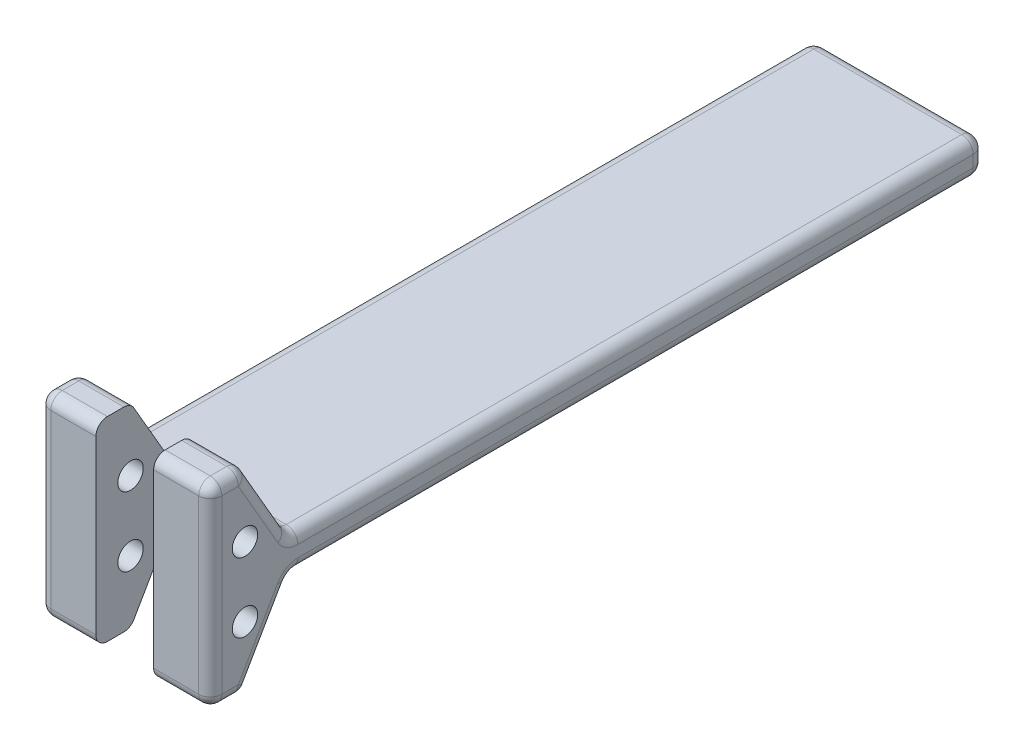
from build123d import *

# Parameters (mm, degrees)
SKETCH_1_W               = 14.8
SKETCH_1_H               = 3
EXTRUDE_1_DEPTH          = 30
EXTRUDE_START            = 2.5
EXTRUDE_2_DEPTH          = 4.9
EXTRUDE_START_2          = -2.5
EXTRUDE_3_DEPTH          = 4.9
FILLET_1_R               = 1
CUT_EXTRUDE_1_DEPTH      = 41.731739622
CUT_EXTRUDE_1_DEPTH_BACK = 41.731739622
SKETCH_4_R               = 1.1


with BuildPart() as part:
    # Эскиз1 → Бобышка-Вытянуть1 (new, symmetric)
    with BuildSketch(Plane.XY):
        Rectangle(SKETCH_1_W, SKETCH_1_H)
    extrude(amount=EXTRUDE_1_DEPTH, both=True)

    # Эскиз3 → Бобышка-Вытянуть2 (add)
    with BuildSketch(Plane(origin=(0, 0, 0), x_dir=(0, 0, -1), z_dir=(1, 0, 0)).offset(EXTRUDE_START)):
        Polygon((-30, 1.5), (-34, 8.42820323), (-37, 8.42820323), (-37, -8.42820323), (-34, -8.42820323), (-30, -1.5), align=None)
    extrude(amount=EXTRUDE_2_DEPTH)

    # Эскиз3<2> → Бобышка-Вытянуть3 (add)
    with BuildSketch(Plane(origin=(0, 0, 0), x_dir=(0, 0, -1), z_dir=(1, 0, 0)).offset(EXTRUDE_START_2)):
        Polygon((-30, 1.5), (-34, 8.42820323), (-37, 8.42820323), (-37, -8.42820323), (-34, -8.42820323), (-30, -1.5), align=None)
    extrude(amount=-EXTRUDE_3_DEPTH)

    # Скругление1
    fillet_1_edges = [part.edges().sort_by_distance(p)[0] for p in [
        (7.4, -4.964101615, 32),
        (4.95, -8.42820323, 34),
        (7.4, -8.42820323, 35.5),
        (4.95, -8.42820323, 37),
        (7.4, 0, 37),
        (4.95, 8.42820323, 37),
        (7.4, 8.42820323, 35.5),
        (4.95, 8.42820323, 34),
        (7.4, 4.964101615, 32),
        (-4.95, -1.5, 30),
        (4.95, -1.5, 30),
        (-4.95, 1.5, 30),
        (-4.95, -8.42820323, 34),
        (-4.95, -8.42820323, 37),
        (-4.95, 8.42820323, 37),
        (-4.95, 8.42820323, 34),
        (-7.4, -4.964101615, 32),
        (-7.4, -8.42820323, 35.5),
        (-7.4, 0, 37),
        (-7.4, 8.42820323, 35.5),
        (-7.4, 4.964101615, 32),
        (0, -1.5, -30),
        (-7.4, 0, -30),
        (0, 1.5, -30),
        (7.4, 0, -30),
        (7.4, -1.5, 0),
        (-7.4, -1.5, 0),
        (-7.4, 1.5, 0),
        (7.4, 1.5, 0),
        (4.95, 1.5, 30),
    ]]
    fillet(fillet_1_edges, radius=FILLET_1_R)

    # Эскиз4 → Вырез-Вытянуть1 (cut, two sides: drawn at the far end of the back side and taken through both)
    with BuildSketch(Plane.ZY.offset(7.4).offset(-CUT_EXTRUDE_1_DEPTH_BACK)):
        with Locations(Location((34, 3, 0), (0, 0, 180))):
            Circle(SKETCH_4_R)
        with Locations(Location((34, -3, 0), (0, 0, 180))):
            Circle(SKETCH_4_R)
    extrude(amount=CUT_EXTRUDE_1_DEPTH + CUT_EXTRUDE_1_DEPTH_BACK, mode=Mode.SUBTRACT)


solid = part.part
